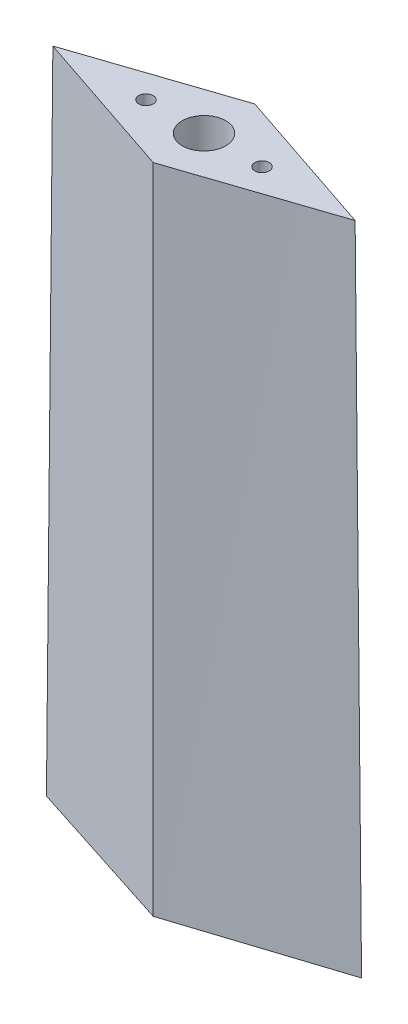
from build123d import *

# Parameters (mm, degrees)
BOSS_EXTRUDE1_DEPTH      = 11.1125
BOSS_EXTRUDE1_DEPTH_BACK = 11.1125
SKETCH5_W                = 109.877468776
SKETCH5_H                = 283.051122129
CUT_EXTRUDE2_DEPTH       = 1193.492852366
SKETCH6_W                = 149.121482991
SKETCH6_H                = 108.921761737
CUT_EXTRUDE3_DEPTH       = 1175.662940665
SKETCH7_R                = 4.7625
CUT_EXTRUDE4_DEPTH       = 635
CUT_EXTRUDE8_DEPTH       = 1195.766301895
CUT_EXTRUDE8_DEPTH_BACK  = 1195.766301895
SKETCH8_W                = 149.774750394
SKETCH8_H                = 148.832770831
SKETCH8_H_2              = 176.125878949
SKETCH8_H_3              = 142.875
SKETCH15_R               = 1.5875
CUT_EXTRUDE13_DEPTH      = 12.7
CUT_EXTRUDE14_START      = -12.7
SKETCH16_R               = 1.5875
CUT_EXTRUDE14_DEPTH      = 12.7


with BuildPart() as part:
    # Sketch1 → Boss-Extrude1 (new, two sides: drawn at the far end of the back side and taken through both)
    with BuildSketch(Plane.XY.offset(-BOSS_EXTRUDE1_DEPTH_BACK)):
        Polygon((142.42123069, 465.168027231), (219.716026672, 465.168027231), (213.502471629, 1096.967634552), (181.068628681, 1174.337215652), (148.634785732, 1096.967634552), align=None)
    extrude(amount=BOSS_EXTRUDE1_DEPTH + BOSS_EXTRUDE1_DEPTH_BACK)

    # Sketch2 → Cut-Loft1 section 0
    with BuildSketch(Plane.XZ.offset(-465.168027231)):
        with BuildLine():
            Line((142.42123069, 0), (181.068628681, 11.1125))
            Line((181.068628681, 11.1125), (219.716026672, 0))
            Line((219.716026672, 0), (222.70513775, 0))
            Line((222.70513775, 0), (222.70513775, 15.258366339))
            Line((222.70513775, 15.258366339), (137.848628215, 15.258366339))
            Line((137.848628215, 15.258366339), (137.848628215, 0))
            Line((137.848628215, 0), (142.42123069, 0))
        make_face()
    # Sketch3 → Cut-Loft1 section 1
    with BuildSketch(Plane(origin=(0, 1096.967634552, 0), x_dir=(1, 0, 0), z_dir=(0, 1, 0))):
        with BuildLine():
            Line((213.502471629, 0), (181.068628681, -11.1125))
            Line((181.068628681, -11.1125), (148.634785732, 0))
            Line((148.634785732, 0), (137.848628215, 0))
            Line((137.848628215, 0), (137.848628215, -15.258366339))
            Line((137.848628215, -15.258366339), (222.70513775, -15.258366339))
            Line((222.70513775, -15.258366339), (222.70513775, 0))
            Line((222.70513775, 0), (213.502471629, 0))
        make_face()
    cut_loft1 = loft(mode=Mode.SUBTRACT)

    # Mirror1: Cut-Loft1 across plane
    add(cut_loft1.mirror(Plane.XY), mode=Mode.SUBTRACT)

    # Sketch5 → Cut-Extrude2 (cut, through all)
    with BuildSketch(Plane(origin=(-32.103098407, 13.457832356, 93.698704331), x_dir=(0.9470206004067627, 0.045661094409327196, 0.31791043842968925), z_dir=(-0.3211728232668741, 0.1346377834927197, 0.937401026696127))):
        with Locations((219.349244299, 1139.303724701)):
            Rectangle(SKETCH5_W, SKETCH5_H)
    cut_extrude2 = extrude(amount=CUT_EXTRUDE2_DEPTH, mode=Mode.SUBTRACT)

    # Sketch6 → Cut-Extrude3 (cut, through all)
    with BuildSketch(Plane(origin=(69.458274406, 29.117370568, 202.726547902), x_dir=(0.9470206004067623, -0.045661094409327495, -0.31791043842969063), z_dir=(0.3211728232668754, 0.13463778349272, 0.9374010266961263))):
        with Locations((131.752816965, 1118.922251835)):
            Rectangle(SKETCH6_W, SKETCH6_H)
    cut_extrude3 = extrude(amount=CUT_EXTRUDE3_DEPTH, mode=Mode.SUBTRACT)

    # Mirror2: Cut-Extrude2, Cut-Extrude3 across plane
    add(cut_extrude2.mirror(Plane.XY), mode=Mode.SUBTRACT)
    add(cut_extrude3.mirror(Plane.XY), mode=Mode.SUBTRACT)

    # Sketch7 → Cut-Extrude4 (cut)
    with BuildSketch(Plane.XZ.offset(-465.168027231)):
        with Locations(Location((181.068628681, 0, 0), (0, 0, 270))):
            Circle(SKETCH7_R)
    extrude(amount=-CUT_EXTRUDE4_DEPTH, mode=Mode.SUBTRACT)

    # Sketch8 → Cut-Extrude8 (cut, two sides: drawn at the far end of the back side and taken through both)
    with BuildSketch(Plane.XY.offset(-CUT_EXTRUDE8_DEPTH_BACK)):
        with Locations((180.5976389, 528.420830237)):
            Rectangle(SKETCH8_W, SKETCH8_H)
        with Locations((180.5976389, 1119.525155127)):
            Rectangle(SKETCH8_W, SKETCH8_H_2)
        with Locations((180.5976389, 674.274715652)):
            Rectangle(SKETCH8_W, SKETCH8_H_3)
        with Locations((180.5976389, 817.149715652)):
            Rectangle(SKETCH8_W, SKETCH8_H_3)
    extrude(amount=CUT_EXTRUDE8_DEPTH + CUT_EXTRUDE8_DEPTH_BACK, mode=Mode.SUBTRACT)

    # Sketch15 → Cut-Extrude13 (cut)
    with BuildSketch(Plane.XZ.offset(-888.587215652)):
        with Locations(Location((168.368628681, 0, 0), (0, 0, 270))):
            Circle(SKETCH15_R)
        with Locations(Location((193.768628681, 0, 0), (0, 0, 270))):
            Circle(SKETCH15_R)
    extrude(amount=-CUT_EXTRUDE13_DEPTH, mode=Mode.SUBTRACT)

    # Sketch16 → Cut-Extrude14 (cut)
    with BuildSketch(Plane(origin=(0, 1031.462215652, 0), x_dir=(1, 0, 0), z_dir=(0, 1, 0)).offset(CUT_EXTRUDE14_START)):
        with Locations(Location((168.368628681, 0, 0), (0, 0, 90))):
            Circle(SKETCH16_R)
        with Locations(Location((193.768628681, 0, 0), (0, 0, 90))):
            Circle(SKETCH16_R)
    extrude(amount=CUT_EXTRUDE14_DEPTH, mode=Mode.SUBTRACT)


solid = part.part
